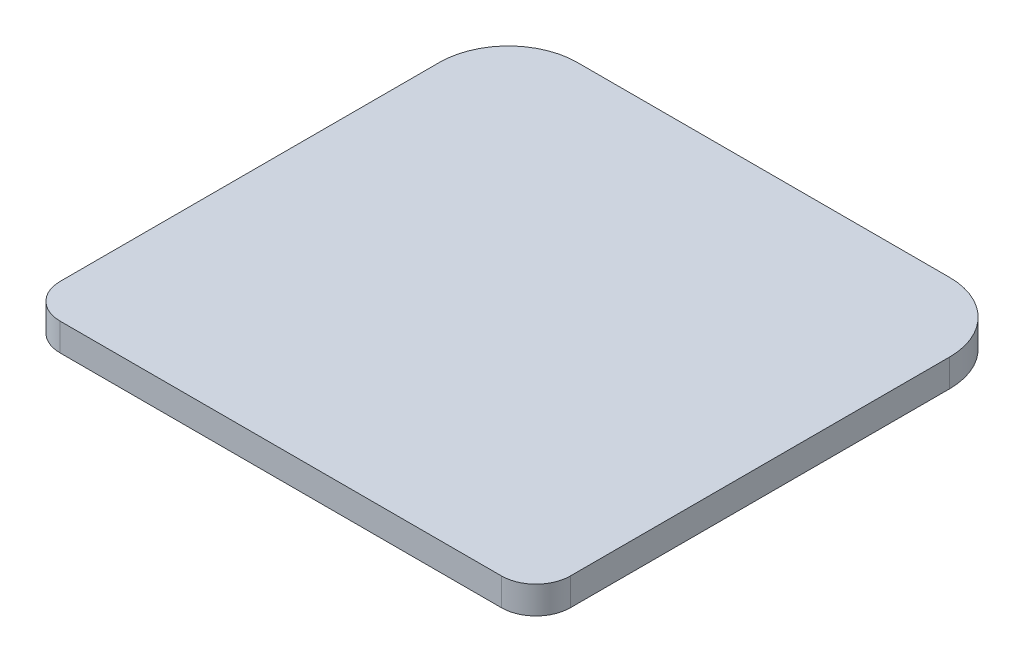
from build123d import *

# Parameters (mm, degrees)
SKETCH1_W           = 14.8
SKETCH1_H           = 14
BOSS_EXTRUDE1_DEPTH = 0.8
FILLET1_R           = 2
FILLET2_R           = 1


with BuildPart() as part:
    # Sketch1 → Boss-Extrude1 (new body)
    with BuildSketch(Plane(origin=(0, 0, 0), x_dir=(1, 0, 0), z_dir=(0, 1, 0))):
        Rectangle(SKETCH1_W, SKETCH1_H)
    extrude(amount=BOSS_EXTRUDE1_DEPTH)

    # Fillet1
    fillet1_edges = [part.edges().sort_by_distance(p)[0] for p in [
        (-7.4, 0.4, -7),
        (7.4, 0.4, -7),
    ]]
    fillet(fillet1_edges, radius=FILLET1_R)

    # Fillet2
    fillet2_edges = [part.edges().sort_by_distance(p)[0] for p in [
        (7.4, 0.4, 7),
        (-7.4, 0.4, 7),
    ]]
    fillet(fillet2_edges, radius=FILLET2_R)


solid = part.part
